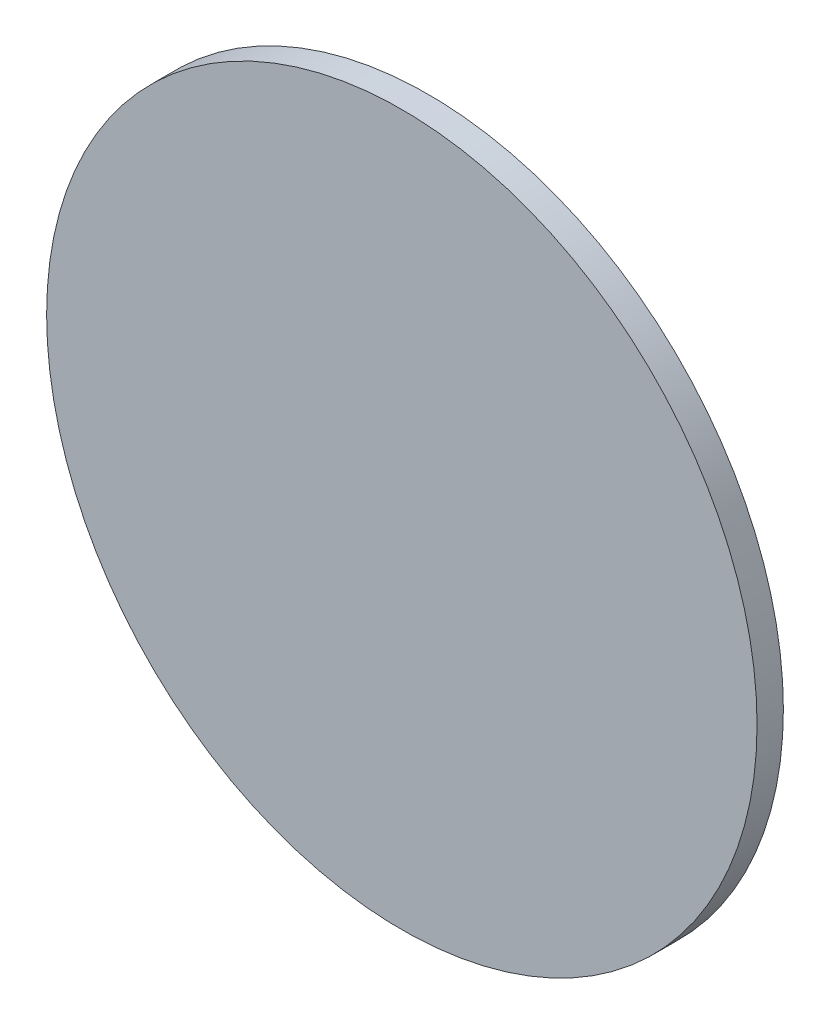
from build123d import *

# Parameters (mm, degrees)
SKETCH_1_R      = 27
EXTRUDE_1_DEPTH = 2


with BuildPart() as part:
    # 草图1 → 凸台-拉伸1 (new body)
    with BuildSketch(Plane.XY):
        Circle(SKETCH_1_R)
    extrude(amount=EXTRUDE_1_DEPTH)


solid = part.part
